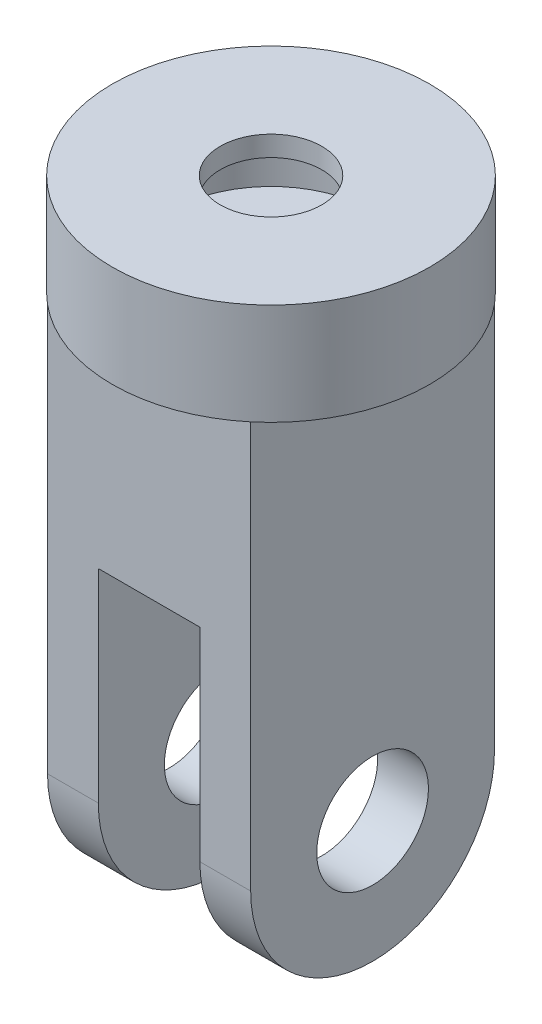
from build123d import *

# Parameters (mm, degrees)
SKETCH1_R           = 2.75
BOSS_EXTRUDE1_DEPTH = 10
SKETCH3_R           = 7.810249676
BOSS_EXTRUDE3_DEPTH = 5
SKETCH4_R           = 5
CUT_EXTRUDE1_DEPTH  = 4
SKETCH5_R           = 6.128825336
SKETCH5_R_2         = 2.5
BOSS_EXTRUDE4_DEPTH = 1
SKETCH7_W           = 20.888038085
SKETCH7_H           = 5
CUT_EXTRUDE2_DEPTH  = 13


with BuildPart() as part:
    # Sketch1 → Boss-Extrude1 (new body)
    with BuildSketch(Plane.YZ):
        with BuildLine():
            Line((0, 6), (20, 6))
            Line((20, 6), (20, -6))
            Line((20, -6), (0, -6))
            ThreePointArc((0, -6), (-6, 0), (0, 6))
        make_face()
        with Locations(Location((0, 0, 0), (0, 0, 270))):
            Circle(SKETCH1_R, mode=Mode.SUBTRACT)
    extrude(amount=BOSS_EXTRUDE1_DEPTH)

    # Sketch3 → Boss-Extrude3 (add)
    with BuildSketch(Plane(origin=(0, 20, 0), x_dir=(-1, 0, 0), z_dir=(0, 1, 0))):
        with Locations(Location((-5, 0, 0), (0, 0, 230.194428908))):
            Circle(SKETCH3_R)
    extrude(amount=BOSS_EXTRUDE3_DEPTH)

    # Sketch4 → Cut-Extrude1 (cut)
    with BuildSketch(Plane(origin=(0, 25, 0), x_dir=(-1, 0, 0), z_dir=(0, 1, 0))):
        with Locations(Location((-5, 0, 0), (0, 0, 90))):
            Circle(SKETCH4_R)
    extrude(amount=-CUT_EXTRUDE1_DEPTH, mode=Mode.SUBTRACT)

    # Sketch5 → Boss-Extrude4 (add)
    with BuildSketch(Plane(origin=(0, 25, 0), x_dir=(-1, 0, 0), z_dir=(0, 1, 0))):
        with Locations((-5, 0)):
            Circle(SKETCH5_R)
        with Locations(Location((-5, 0, 0), (0, 0, 90))):
            Circle(SKETCH5_R_2, mode=Mode.SUBTRACT)
    extrude(amount=-BOSS_EXTRUDE4_DEPTH)

    # Sketch7 → Cut-Extrude2 (cut, symmetric)
    with BuildSketch(Plane(origin=(0, 0, 0), x_dir=(0, 1, 0), z_dir=(0, 0, 1))):
        with Locations((-0.444019042, -5)):
            Rectangle(SKETCH7_W, SKETCH7_H)
    extrude(amount=CUT_EXTRUDE2_DEPTH, both=True, mode=Mode.SUBTRACT)


solid = part.part
